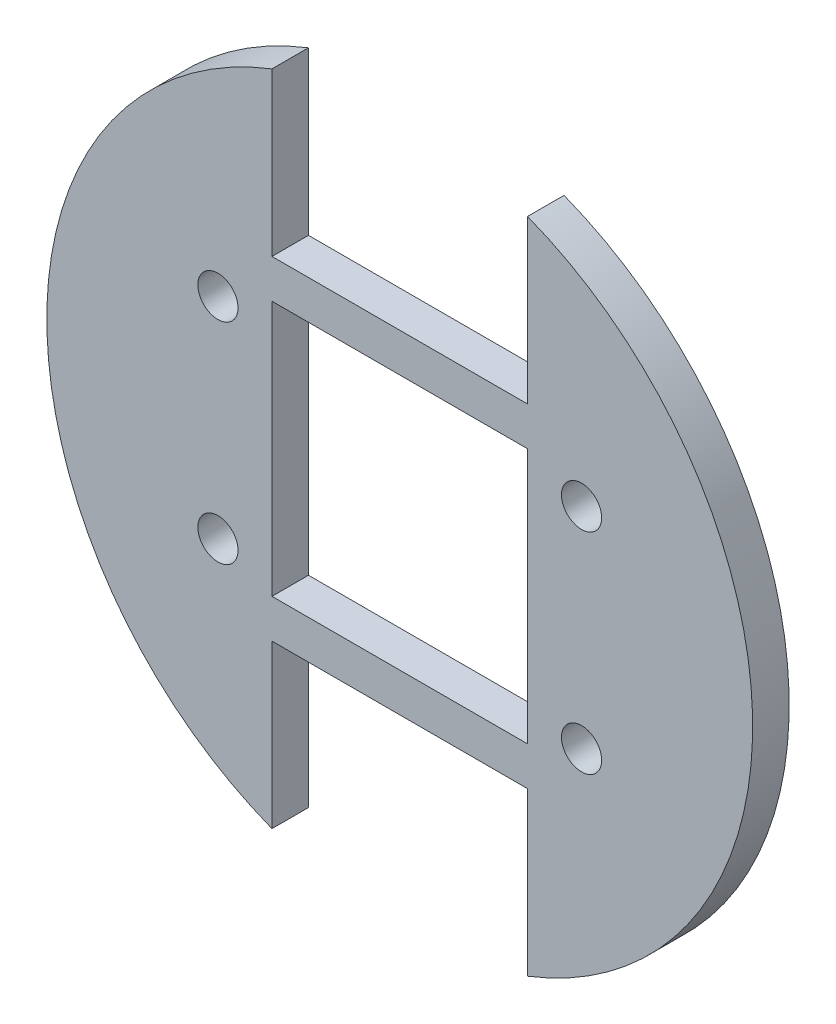
from build123d import *

# Parameters (mm, degrees)
SKETCH_1_R      = 1.65
SKETCH_1_W      = 21
SKETCH_1_H      = 21
EXTRUDE_1_DEPTH = 3


with BuildPart() as part:
    # 草图1 → 凸台-拉伸1 (new body)
    with BuildSketch(Plane.XY):
        with BuildLine():
            Line((10.5, -13.686215693), (10.5, -27.032387982))
            ThreePointArc((10.5, -27.032387982), (29, 0), (10.5, 27.032387982))
            Line((10.5, 27.032387982), (10.5, 13.686215693))
            Line((10.5, 13.686215693), (-10.5, 13.686215693))
            Line((-10.5, 13.686215693), (-10.5, 27.032387982))
            ThreePointArc((-10.5, 27.032387982), (-29, 0), (-10.5, -27.032387982))
            Line((-10.5, -27.032387982), (-10.5, -13.686215693))
            Line((-10.5, -13.686215693), (10.5, -13.686215693))
        make_face()
        with Locations((14.938938215, 8.625)):
            Circle(SKETCH_1_R, mode=Mode.SUBTRACT)
        with Locations((14.938938215, -8.625)):
            Circle(SKETCH_1_R, mode=Mode.SUBTRACT)
        with Locations((-14.938938215, -8.625)):
            Circle(SKETCH_1_R, mode=Mode.SUBTRACT)
        with Locations((-14.938938215, 8.625)):
            Circle(SKETCH_1_R, mode=Mode.SUBTRACT)
        Rectangle(SKETCH_1_W, SKETCH_1_H, mode=Mode.SUBTRACT)
    extrude(amount=EXTRUDE_1_DEPTH)


solid = part.part
